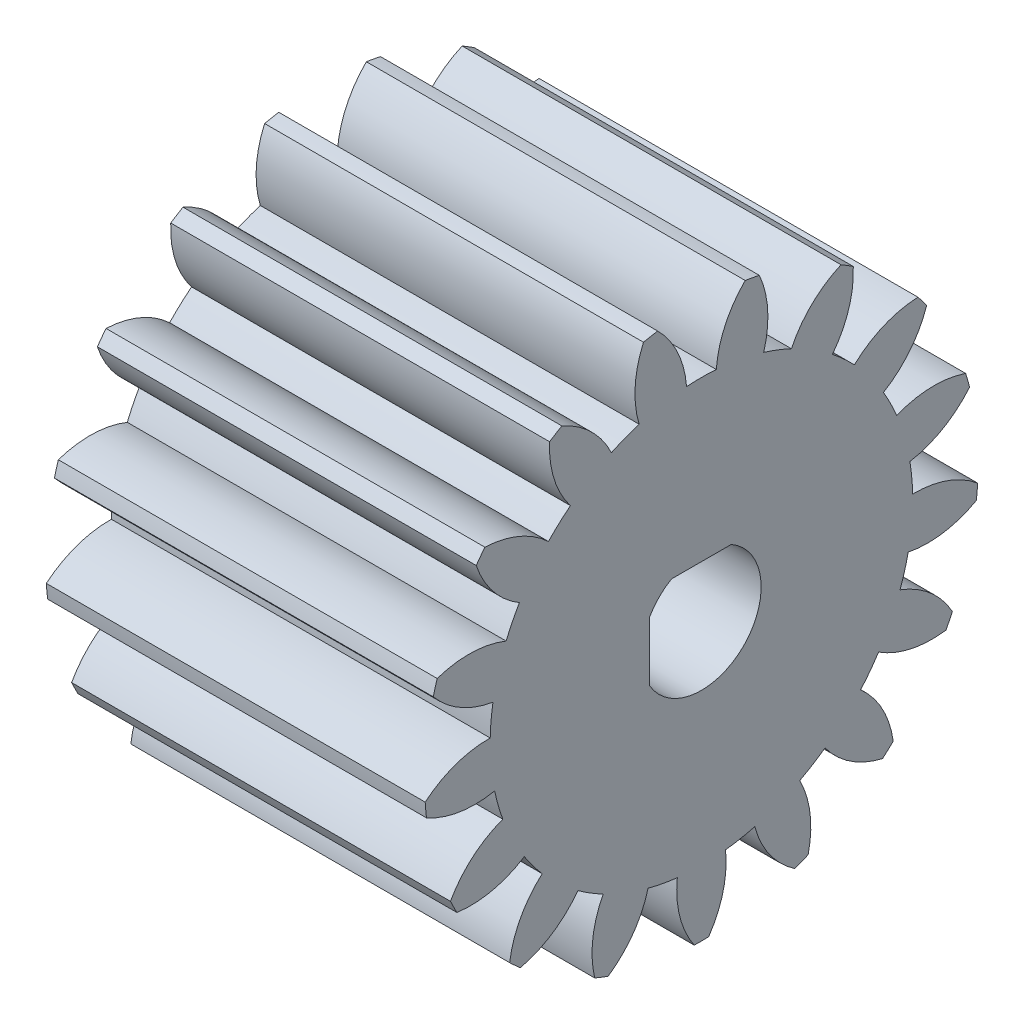
from build123d import *

# Parameters (mm, degrees)
BASPROSKE_W     = 26
BASPROSKE_H     = 19
TOOTHCUT_DEPTH  = 38.389838192
TEETHCUTS_COUNT = 17
TEETHCUTS_ANGLE = 338.823529412
BORE_DEPTH      = 50.0000508


with BuildPart() as part:
    # BasProSke → Base-Revolve (revolve)
    with BuildSketch(Plane(origin=(0, 0, 0), x_dir=(1, 0, 0), z_dir=(0, 1, 0)), mode=Mode.PRIVATE) as base_revolve_sk:
        with Locations((13, 9.5)):
            Rectangle(BASPROSKE_W, BASPROSKE_H)
    revolve(base_revolve_sk.sketch.rotate(Axis((-10, 0, 0), (1, 0, 0)), 180), axis=Axis((-10, 0, 0), (1, 0, 0)))

    # TooCutSke → ToothCut (cut, through all)
    with BuildSketch(Plane(origin=(0, 0, 0), x_dir=(0, 0, -1), z_dir=(1, 0, 0))):
        with BuildLine():
            ThreePointArc((1.020352389, 14.463052306), (0, 14.499), (-1.020352389, 14.463052306))
            ThreePointArc((-1.020352389, 14.463052306), (-1.632621885, 16.804485203), (-3.026143023, 18.783192049))
            ThreePointArc((-3.026143023, 18.783192049), (0, 19.0254), (3.026143023, 18.783192049))
            ThreePointArc((3.026143023, 18.783192049), (1.632621885, 16.804485203), (1.020352389, 14.463052306))
        make_face()
    toothcut = extrude(amount=TOOTHCUT_DEPTH, mode=Mode.SUBTRACT)

    # TeethCuts: ToothCut ×17 about axis
    teethcuts_axis = Axis((-10, 0, 0), (1, 0, 0))
    for i in range(1, TEETHCUTS_COUNT):
        add(toothcut.rotate(teethcuts_axis, i * TEETHCUTS_ANGLE / (TEETHCUTS_COUNT - 1)), mode=Mode.SUBTRACT)

    # BorSke → Bore (cut, symmetric)
    with BuildSketch(Plane(origin=(0, 0, 0), x_dir=(0, 0, -1), z_dir=(1, 0, 0))):
        with BuildLine():
            Line((-3.55, 2.05121915), (-3.55, -2.05121915))
            ThreePointArc((-3.55, -2.05121915), (2.899137803, -2.899137803), (2.05121915, 3.55))
            Line((2.05121915, 3.55), (-2.05121915, 3.55))
            ThreePointArc((-2.05121915, 3.55), (-2.899137803, 2.899137803), (-3.55, 2.05121915))
        make_face()
    extrude(amount=BORE_DEPTH, both=True, mode=Mode.SUBTRACT)


solid = part.part
